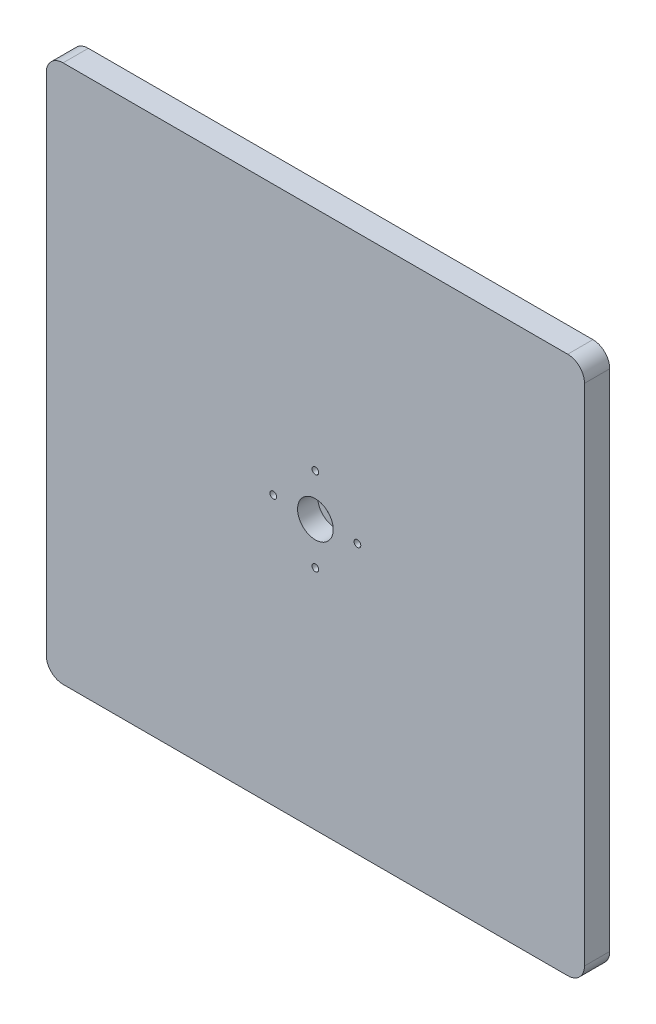
from build123d import *

# Parameters (mm, degrees)
BOSS_EXTRUDE1_DEPTH = 15
SKETCH2_R           = 10.6
CUT_EXTRUDE1_DEPTH  = 12
SKETCH3_R           = 6.5
CUT_EXTRUDE2_DEPTH  = 10
SKETCH4_R           = 2
CUT_EXTRUDE3_DEPTH  = 15


with BuildPart() as part:
    # Sketch1 → Boss-Extrude1 (new body)
    with BuildSketch(Plane.XY):
        with BuildLine():
            Line((-150, 160), (150, 160))
            ThreePointArc((150, 160), (157.071067812, 157.071067812), (160, 150))
            Line((160, 150), (160, -150))
            ThreePointArc((160, -150), (157.071067812, -157.071067812), (150, -160))
            Line((150, -160), (-150, -160))
            ThreePointArc((-150, -160), (-157.071067812, -157.071067812), (-160, -150))
            Line((-160, -150), (-160, 150))
            ThreePointArc((-160, 150), (-157.071067812, 157.071067812), (-150, 160))
        make_face()
    extrude(amount=BOSS_EXTRUDE1_DEPTH)

    # Sketch2 → Cut-Extrude1 (cut)
    with BuildSketch(Plane.XY.offset(15)):
        Circle(SKETCH2_R)
    extrude(amount=-CUT_EXTRUDE1_DEPTH, mode=Mode.SUBTRACT)

    # Sketch3 → Cut-Extrude2 (cut)
    with BuildSketch(Plane.XY.offset(3)):
        Circle(SKETCH3_R)
    extrude(amount=-CUT_EXTRUDE2_DEPTH, mode=Mode.SUBTRACT)

    # Sketch4 → Cut-Extrude3 (cut)
    with BuildSketch(Plane.XY.offset(15)):
        with Locations((0, 25)):
            Circle(SKETCH4_R)
        with Locations((25, 0)):
            Circle(SKETCH4_R)
        with Locations((0, -25)):
            Circle(SKETCH4_R)
        with Locations((-25, 0)):
            Circle(SKETCH4_R)
    extrude(amount=-CUT_EXTRUDE3_DEPTH, mode=Mode.SUBTRACT)


solid = part.part
